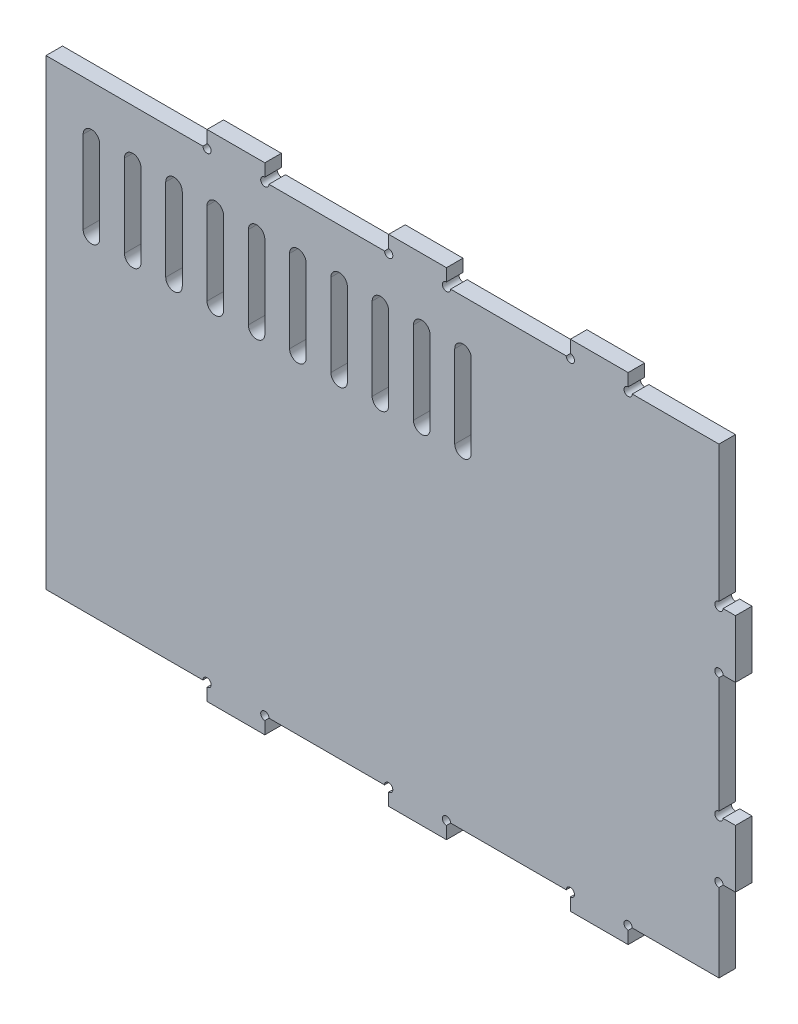
from build123d import *

# Parameters (mm, degrees)
SKETCH_1_W             = 95
SKETCH_1_H             = 56
EXTRUDE_1_DEPTH        = 2
SKETCH_3_W             = 13.5
SKETCH_3_H             = 56
CUT_EXTRUDE_2_DEPTH    = 111.29505882
CUT_EXTRUDE_4_DEPTH    = 111.29505882
PATTERN_LINEAR_1_COUNT = 10
PATTERN_LINEAR_1_PITCH = 5
SKETCH_10_W            = 7
SKETCH_10_H            = 2
EXTRUDE_2_DEPTH        = 2
SKETCH_11_R            = 0.5
CUT_EXTRUDE_7_DEPTH    = 112.323851892
SKETCH_13_W            = 2
SKETCH_13_H            = 7
EXTRUDE_4_DEPTH        = 2
SKETCH_14_R            = 0.5
CUT_EXTRUDE_8_DEPTH    = 114.035392687


with BuildPart() as part:
    # 草图1 → 凸台-拉伸1 (new body)
    with BuildSketch(Plane.XY):
        with Locations((47.5, 28)):
            Rectangle(SKETCH_1_W, SKETCH_1_H)
    extrude(amount=EXTRUDE_1_DEPTH)

    # 草图3 → 切除-拉伸2 (cut, through all)
    with BuildSketch(Plane(origin=(0, 0, 0), x_dir=(-1, 0, 0), z_dir=(0, 0, -1))):
        with Locations((-6.75, 28)):
            Rectangle(SKETCH_3_W, SKETCH_3_H)
    extrude(amount=-CUT_EXTRUDE_2_DEPTH, mode=Mode.SUBTRACT)

    # 草图6 → 切除-拉伸4 (cut, through all)
    with BuildSketch(Plane(origin=(0, 0, 0), x_dir=(-1, 0, 0), z_dir=(0, 0, -1))):
        with BuildLine():
            Line((-63, 50), (-63, 40))
            ThreePointArc((-63, 40), (-64, 39), (-65, 40))
            Line((-65, 40), (-65, 50))
            ThreePointArc((-65, 50), (-64, 51), (-63, 50))
        make_face()
    cut_extrude_4 = extrude(amount=-CUT_EXTRUDE_4_DEPTH, mode=Mode.SUBTRACT)

    # 阵列(线性)1: 切除-拉伸4 ×10
    with Locations(*[(-i * PATTERN_LINEAR_1_PITCH, 0, 0) for i in range(1, PATTERN_LINEAR_1_COUNT)]):
        add(cut_extrude_4, mode=Mode.SUBTRACT)

    # 草图10 → 凸台-拉伸2 (add)
    with BuildSketch(Plane(origin=(0, 0, 0), x_dir=(-1, 0, 0), z_dir=(0, 0, -1))):
        with Locations((-36.5, 57)):
            Rectangle(SKETCH_10_W, SKETCH_10_H)
        with Locations((-80.5, 57)):
            Rectangle(SKETCH_10_W, SKETCH_10_H)
        with Locations((-58.5, 57)):
            Rectangle(SKETCH_10_W, SKETCH_10_H)
        with Locations((-80.5, -1)):
            Rectangle(SKETCH_10_W, SKETCH_10_H)
        with Locations((-58.5, -1)):
            Rectangle(SKETCH_10_W, SKETCH_10_H)
        with Locations((-36.5, -1)):
            Rectangle(SKETCH_10_W, SKETCH_10_H)
    extrude(amount=-EXTRUDE_2_DEPTH)

    # 草图11 → 切除-拉伸7 (cut, through all)
    with BuildSketch(Plane(origin=(0, 0, 0), x_dir=(-1, 0, 0), z_dir=(0, 0, -1))):
        with Locations((-84, 56)):
            Circle(SKETCH_11_R)
        with Locations((-77, 56)):
            Circle(SKETCH_11_R)
        with Locations((-62, 56)):
            Circle(SKETCH_11_R)
        with Locations((-55, 56)):
            Circle(SKETCH_11_R)
        with Locations((-40, 56)):
            Circle(SKETCH_11_R)
        with Locations((-33, 56)):
            Circle(SKETCH_11_R)
        with Locations((-84, 0)):
            Circle(SKETCH_11_R)
        with Locations((-77, 0)):
            Circle(SKETCH_11_R)
        with Locations((-62, 0)):
            Circle(SKETCH_11_R)
        with Locations((-55, 0)):
            Circle(SKETCH_11_R)
        with Locations((-40, 0)):
            Circle(SKETCH_11_R)
        with Locations((-33, 0)):
            Circle(SKETCH_11_R)
    extrude(amount=-CUT_EXTRUDE_7_DEPTH, mode=Mode.SUBTRACT)

    # 草图13 → 凸台-拉伸4 (add)
    with BuildSketch(Plane(origin=(0, 0, 0), x_dir=(-1, 0, 0), z_dir=(0, 0, -1))):
        with Locations((-96, 13.5)):
            Rectangle(SKETCH_13_W, SKETCH_13_H)
        with Locations((-96, 35.5)):
            Rectangle(SKETCH_13_W, SKETCH_13_H)
    extrude(amount=-EXTRUDE_4_DEPTH)

    # 草图14 → 切除-拉伸8 (cut, through all)
    with BuildSketch(Plane(origin=(0, 0, 0), x_dir=(-1, 0, 0), z_dir=(0, 0, -1))):
        with Locations((-95, 39)):
            Circle(SKETCH_14_R)
        with Locations((-95, 32)):
            Circle(SKETCH_14_R)
        with Locations((-95, 17)):
            Circle(SKETCH_14_R)
        with Locations((-95, 10)):
            Circle(SKETCH_14_R)
    extrude(amount=-CUT_EXTRUDE_8_DEPTH, mode=Mode.SUBTRACT)


solid = part.part
